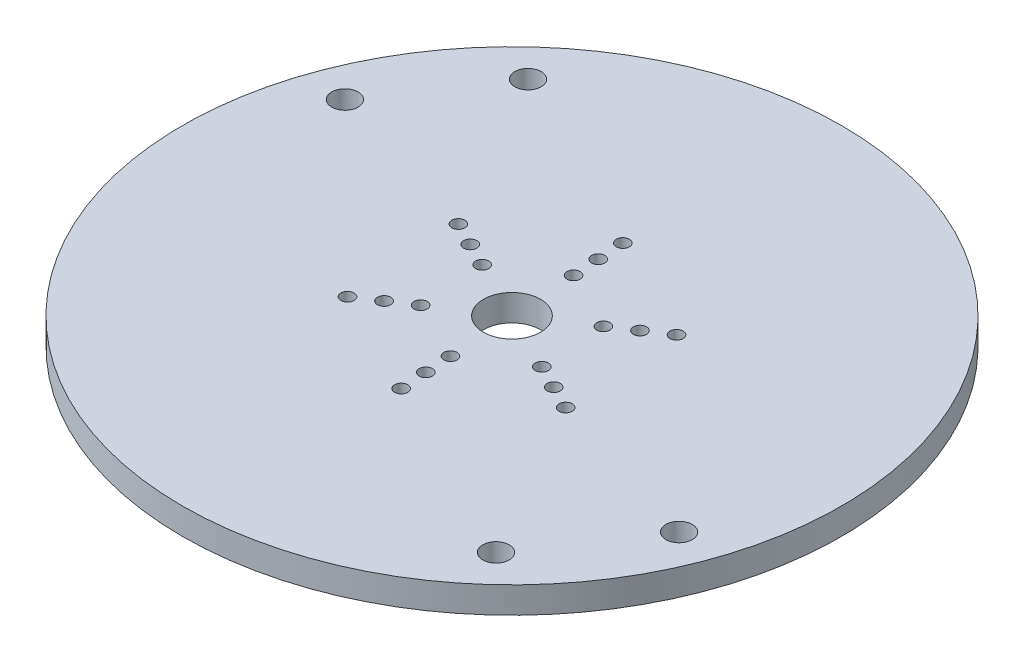
from build123d import *

# Parameters (mm, degrees)
SKETCH1_R           = 37.5
SKETCH1_R_2         = 0.75
SKETCH1_R_3         = 3.25
SKETCH1_R_4         = 1.5
BOSS_EXTRUDE1_DEPTH = 3


with BuildPart() as part:
    # Sketch1 → Boss-Extrude1 (new body)
    with BuildSketch(Plane(origin=(0, 0, 0), x_dir=(1, 0, 0), z_dir=(0, 1, 0))):
        with Locations(Location((0, 0, 0), (0, 0, 270))):
            Circle(SKETCH1_R)
        with Locations(Location((-0.863160321, 13.472377454, 0), (0, 0, 270))):
            Circle(SKETCH1_R_2, mode=Mode.SUBTRACT)
        with Locations(Location((-0.671346916, 10.478515797, 0), (0, 0, 270))):
            Circle(SKETCH1_R_2, mode=Mode.SUBTRACT)
        with Locations(Location((-0.479533512, 7.484654141, 0), (0, 0, 270))):
            Circle(SKETCH1_R_2, mode=Mode.SUBTRACT)
        with Locations(Location((6.242133869, 4.157615274, 0), (0, 0, 270))):
            Circle(SKETCH1_R_2, mode=Mode.SUBTRACT)
        with Locations(Location((8.738987416, 5.820661383, 0), (0, 0, 270))):
            Circle(SKETCH1_R_2, mode=Mode.SUBTRACT)
        with Locations(Location((11.235840964, 7.483707492, 0), (0, 0, 270))):
            Circle(SKETCH1_R_2, mode=Mode.SUBTRACT)
        with Locations(Location((-12.099001285, 5.988669961, 0), (0, 0, 270))):
            Circle(SKETCH1_R_2, mode=Mode.SUBTRACT)
        with Locations(Location((-9.410334333, 4.657854414, 0), (0, 0, 270))):
            Circle(SKETCH1_R_2, mode=Mode.SUBTRACT)
        with Locations(Location((-6.721667381, 3.327038867, 0), (0, 0, 270))):
            Circle(SKETCH1_R_2, mode=Mode.SUBTRACT)
        with Locations(Location((6.721667381, -3.327038867, 0), (0, 0, 270))):
            Circle(SKETCH1_R_2, mode=Mode.SUBTRACT)
        with Locations(Location((9.410334333, -4.657854414, 0), (0, 0, 270))):
            Circle(SKETCH1_R_2, mode=Mode.SUBTRACT)
        with Locations(Location((12.099001285, -5.988669961, 0), (0, 0, 270))):
            Circle(SKETCH1_R_2, mode=Mode.SUBTRACT)
        with Locations(Location((-11.235840964, -7.483707492, 0), (0, 0, 270))):
            Circle(SKETCH1_R_2, mode=Mode.SUBTRACT)
        with Locations(Location((-8.738987416, -5.820661383, 0), (0, 0, 270))):
            Circle(SKETCH1_R_2, mode=Mode.SUBTRACT)
        with Locations(Location((-6.242133869, -4.157615274, 0), (0, 0, 270))):
            Circle(SKETCH1_R_2, mode=Mode.SUBTRACT)
        with Locations(Location((0.479533512, -7.484654141, 0), (0, 0, 270))):
            Circle(SKETCH1_R_2, mode=Mode.SUBTRACT)
        with Locations(Location((0.671346916, -10.478515797, 0), (0, 0, 270))):
            Circle(SKETCH1_R_2, mode=Mode.SUBTRACT)
        with Locations(Location((0.863160321, -13.472377454, 0), (0, 0, 270))):
            Circle(SKETCH1_R_2, mode=Mode.SUBTRACT)
        with Locations(Location((0, 0, 0), (0, 0, 270))):
            Circle(SKETCH1_R_3, mode=Mode.SUBTRACT)
        with Locations(Location((-22.406587981, 24.226943989, 0), (0, 0, 270))):
            Circle(SKETCH1_R_4, mode=Mode.SUBTRACT)
        with Locations(Location((-30.815927231, 11.805872643, 0), (0, 0, 270))):
            Circle(SKETCH1_R_4, mode=Mode.SUBTRACT)
        with Locations(Location((30.815927231, -11.805872643, 0), (0, 0, 270))):
            Circle(SKETCH1_R_4, mode=Mode.SUBTRACT)
        with Locations(Location((22.406587981, -24.226943989, 0), (0, 0, 270))):
            Circle(SKETCH1_R_4, mode=Mode.SUBTRACT)
    extrude(amount=BOSS_EXTRUDE1_DEPTH)


solid = part.part
